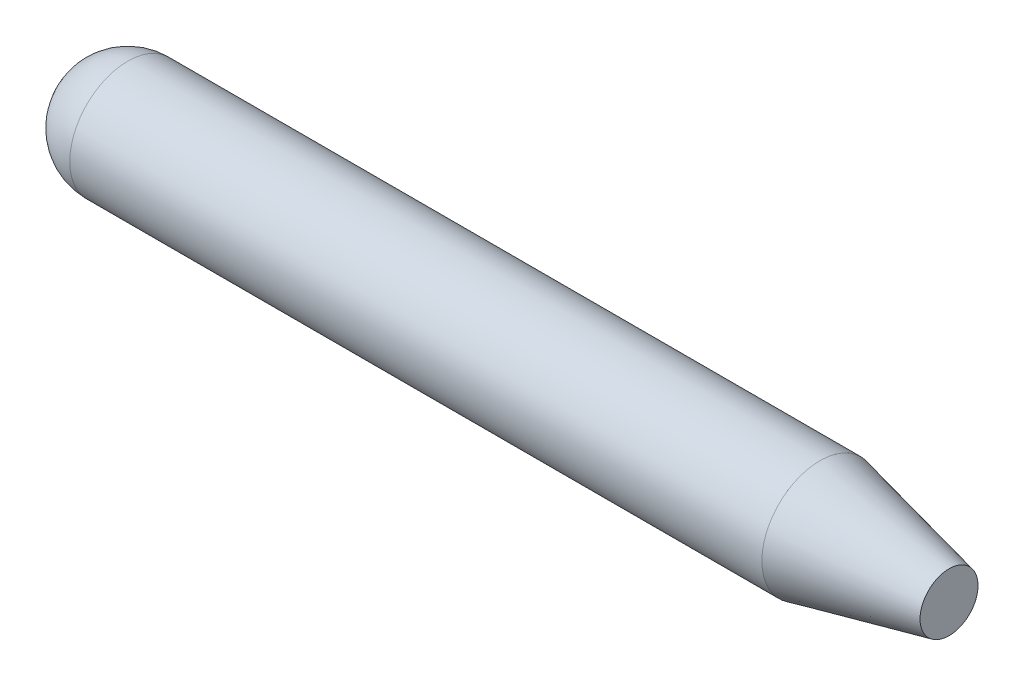
from build123d import *


with BuildPart() as part:
    # Sketch1 → Revolve1 (revolve)
    with BuildSketch(Plane.XY, mode=Mode.PRIVATE) as revolve1_sk:
        with BuildLine():
            Line((68.58, 68.58), (887.407793025, 68.58))
            Line((887.407793025, 68.58), (1040.275199788, 34.325403524))
            Line((1040.275199788, 34.325403524), (1040.275199788, 0))
            Line((1040.275199788, 0), (0, 0))
            ThreePointArc((0, 0), (20.086616946, 48.493383054), (68.58, 68.58))
        make_face()
    revolve(revolve1_sk.sketch.rotate(Axis((0, 0, 0), (1, 0, 0)), 90), axis=Axis((0, 0, 0), (1, 0, 0)))


solid = part.part
